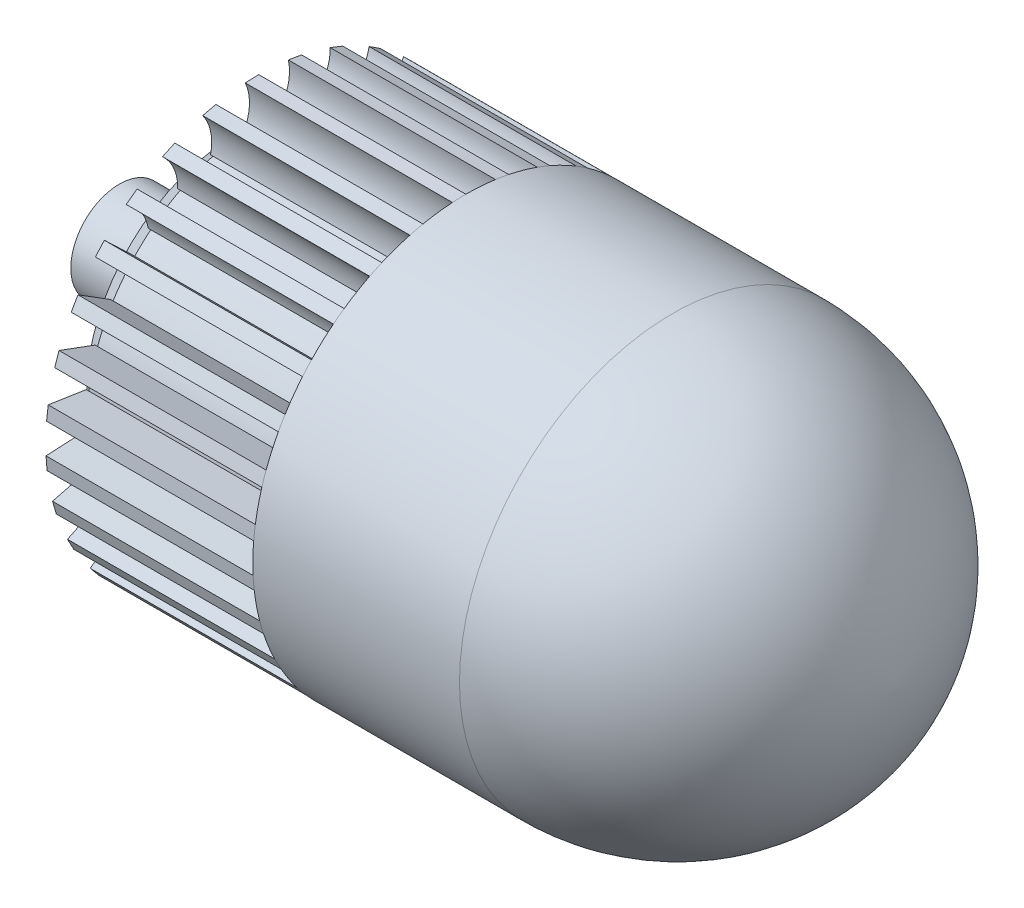
from build123d import *

# Parameters (mm, degrees)
BOSS_EXTRUDE1_DEPTH = 27
CIRPATTERN1_COUNT   = 31


with BuildPart() as part:
    # Sketch1 → Revolve1 (revolve)
    with BuildSketch(Plane.XY, mode=Mode.PRIVATE) as revolve1_sk:
        with BuildLine():
            Line((14.835685253, 0), (14.835685253, 6.327073891))
            Line((14.835685253, 6.327073891), (29.657803747, 6.327073891))
            Line((29.657803747, 6.327073891), (29.657803747, 19.077283347))
            Line((29.657803747, 19.077283347), (33.323488965, 22.742968566))
            Line((33.323488965, 22.742968566), (60.002583426, 22.742968566))
            Line((60.002583426, 22.742968566), (60.002583426, 27.76336354))
            Line((60.002583426, 27.76336354), (86.937400903, 27.76336354))
            ThreePointArc((86.937400903, 27.76336354), (107.04830062, 19.709310079), (116.040472815, 0))
            Line((116.040472815, 0), (14.835685253, 0))
        make_face()
    revolve(revolve1_sk.sketch.rotate(Axis((0, 0, 0), (1, 0, 0)), 90), axis=Axis((0, 0, 0), (1, 0, 0)))

    # Sketch2 → Boss-Extrude1 (add)
    with BuildSketch(Plane.ZY.offset(-60.002583426)):
        with BuildLine():
            Line((0, 22.742968566), (0, 27.76336354))
            Line((0, 27.76336354), (1.753072319, 27.707960814))
            ThreePointArc((1.753072319, 27.707960814), (1.206739892, 25.191631802), (1.753072319, 22.675302791))
            ThreePointArc((1.753072319, 22.675302791), (0.877188864, 22.726045826), (0, 22.742968566))
        make_face()
    boss_extrude1 = extrude(amount=BOSS_EXTRUDE1_DEPTH)

    # CirPattern1: Boss-Extrude1 ×31 about axis
    cirpattern1_axis = Axis((0, 0, 0), (1, 0, 0))
    for i in range(1, CIRPATTERN1_COUNT):
        add(boss_extrude1.rotate(cirpattern1_axis, i * 360 / CIRPATTERN1_COUNT))


solid = part.part
